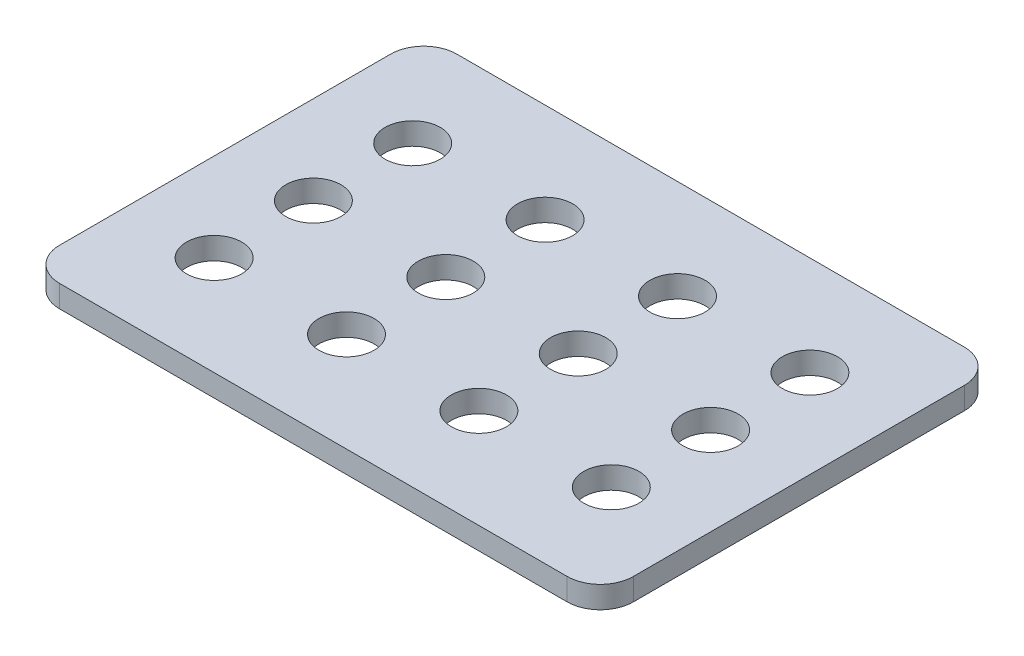
from build123d import *

# Parameters (mm, degrees)
SKETCH1_R           = 12.5
BOSS_EXTRUDE4_DEPTH = 10


with BuildPart() as part:
    # Sketch1 → Boss-Extrude4 (new body)
    # profile 1 of 2: a face of its own
    with BuildSketch(Plane(origin=(0, 0, 0), x_dir=(1, 0, 0), z_dir=(0, 1, 0))):
        with BuildLine():
            Line((0, 165), (0, 15))
            ThreePointArc((0, 15), (4.393398282, 4.393398282), (15, 0))
            Line((15, 0), (130, 0))
            Line((130, 0), (130, 180))
            Line((130, 180), (15, 180))
            ThreePointArc((15, 180), (4.393398282, 175.606601718), (0, 165))
        make_face()
        with Locations(Location((40, 45, 0), (0, 0, 270))):
            Circle(SKETCH1_R, mode=Mode.SUBTRACT)
        with Locations(Location((100, 45, 0), (0, 0, 270))):
            Circle(SKETCH1_R, mode=Mode.SUBTRACT)
        with Locations(Location((40, 90, 0), (0, 0, 270))):
            Circle(SKETCH1_R, mode=Mode.SUBTRACT)
        with Locations(Location((100, 90, 0), (0, 0, 270))):
            Circle(SKETCH1_R, mode=Mode.SUBTRACT)
        with Locations(Location((40, 135, 0), (0, 0, 270))):
            Circle(SKETCH1_R, mode=Mode.SUBTRACT)
        with Locations(Location((100, 135, 0), (0, 0, 270))):
            Circle(SKETCH1_R, mode=Mode.SUBTRACT)
    # profile 2 of 2: a face of its own
    with BuildSketch(Plane(origin=(0, 0, 0), x_dir=(1, 0, 0), z_dir=(0, 1, 0))):
        with BuildLine():
            Line((130, 180), (130, 0))
            Line((130, 0), (245, 0))
            ThreePointArc((245, 0), (255.606601718, 4.393398282), (260, 15))
            Line((260, 15), (260, 165))
            ThreePointArc((260, 165), (255.606601718, 175.606601718), (245, 180))
            Line((245, 180), (130, 180))
        make_face()
        with Locations(Location((160, 45, 0), (0, 0, 270))):
            Circle(SKETCH1_R, mode=Mode.SUBTRACT)
        with Locations(Location((220, 45, 0), (0, 0, 270))):
            Circle(SKETCH1_R, mode=Mode.SUBTRACT)
        with Locations(Location((160, 90, 0), (0, 0, 270))):
            Circle(SKETCH1_R, mode=Mode.SUBTRACT)
        with Locations(Location((220, 90, 0), (0, 0, 270))):
            Circle(SKETCH1_R, mode=Mode.SUBTRACT)
        with Locations(Location((160, 135, 0), (0, 0, 270))):
            Circle(SKETCH1_R, mode=Mode.SUBTRACT)
        with Locations(Location((220, 135, 0), (0, 0, 270))):
            Circle(SKETCH1_R, mode=Mode.SUBTRACT)
    extrude(amount=BOSS_EXTRUDE4_DEPTH)


solid = part.part
